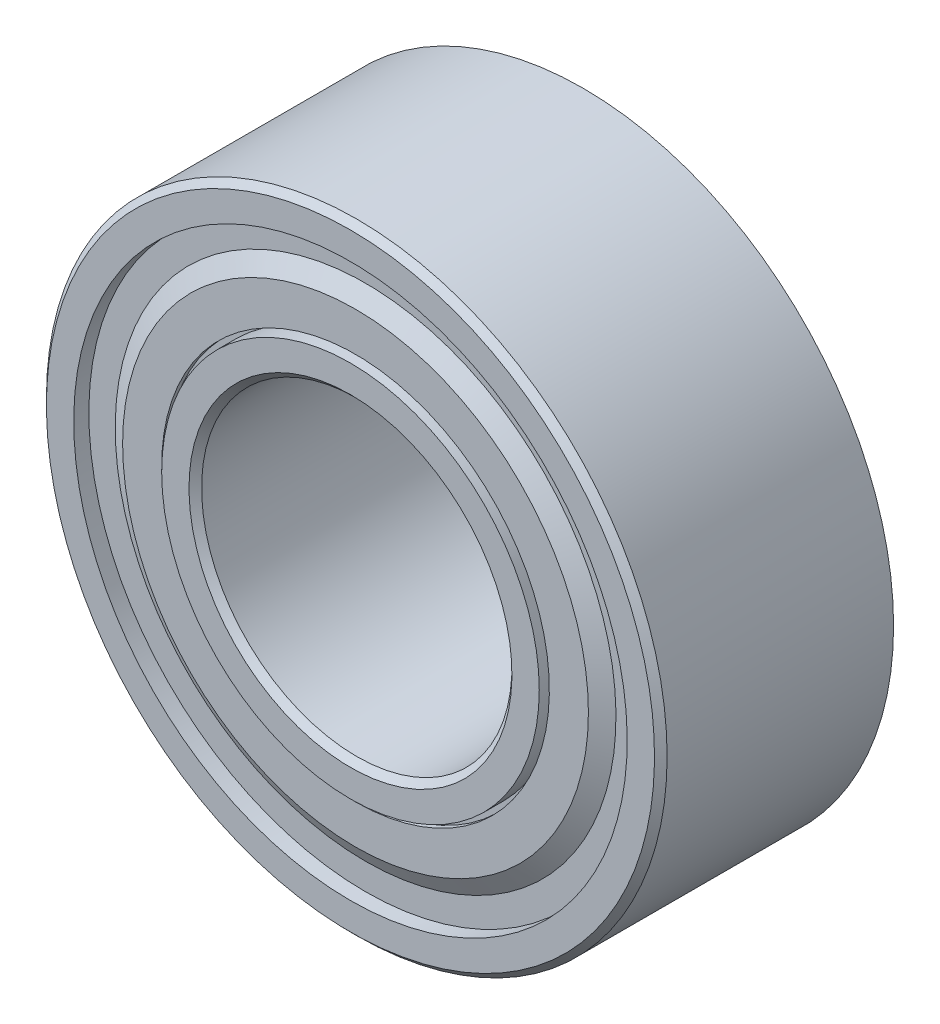
from build123d import *

# Parameters (mm, degrees)
FILLET1_SIZE            = 0.08125
FILLET2_SIZE            = 0.08125
CIRPATTERN3_COUNT       = 12
SKETCH8_W               = 0.26
SKETCH8_H               = 0.216666667
CUT_EXTRUDE1_DEPTH      = 8.163797875
CUT_EXTRUDE1_DEPTH_BACK = 8.163797875
SKETCH10_R              = 4.6
SKETCH10_R_2            = 4
BOSS_EXTRUDE1_START     = 0.397747564
SKETCH11_R              = 4
BOSS_EXTRUDE1_DEPTH     = 0.397747564
CUT_EXTRUDE2_DEPTH      = 7.046281526
CUT_EXTRUDE2_DEPTH_BACK = 7.046281526
SKETCH12_R              = 2


with BuildPart() as part:
    # Sketch2 → Revolve1 (revolve)
    with BuildSketch(Plane(origin=(0, 0, 0), x_dir=(0, 0, -1), z_dir=(1, 0, 0)), mode=Mode.PRIVATE) as revolve1_sk:
        with BuildLine():
            Line((1.5, 4.6), (0.9, 4.6))
            Line((0.9, 4.6), (0.9, 4.265165043))
            Line((0.9, 4.265165043), (1.032582521, 4.132582521))
            Line((1.032582521, 4.132582521), (1.032582521, 3.867417479))
            Line((1.032582521, 3.867417479), (0.767417479, 3.867417479))
            Line((0.767417479, 3.867417479), (0.634834957, 4))
            Line((0.634834957, 4), (-1.5, 4))
            Line((-1.5, 4), (-1.5, 3.35))
            Line((-1.5, 3.35), (-0.487339717, 3.35))
            ThreePointArc((-0.487339717, 3.35), (0, 3.6), (0.487339717, 3.35))
            Line((0.487339717, 3.35), (1.5, 3.35))
            Line((1.5, 3.35), (1.5, 4.6))
        make_face()
        with BuildLine():
            Line((1.5, 2), (-1.5, 2))
            Line((-1.5, 2), (-1.5, 2.65))
            Line((-1.5, 2.65), (-0.487339717, 2.65))
            ThreePointArc((-0.487339717, 2.65), (0, 2.4), (0.487339717, 2.65))
            Line((0.487339717, 2.65), (1.5, 2.65))
            Line((1.5, 2.65), (1.5, 2))
        make_face()
    revolve(revolve1_sk.sketch.rotate(Axis((0, 0, 0), (0, 0, -1)), 180), axis=Axis((0, 0, 0), (0, 0, -1)))

    # Fillet1
    fillet1_edges = [part.edges().sort_by_distance(p)[0] for p in [
        (0, 4, 1.5),
        (0, 4.6, -1.5),
        (0, 4.6, -0.9),
    ]]
    chamfer(fillet1_edges, length=FILLET1_SIZE)

    # Fillet2
    fillet2_edges = [part.edges().sort_by_distance(p)[0] for p in [
        (0, 2, -1.5),
        (0, 2, 1.5),
    ]]
    chamfer(fillet2_edges, length=FILLET2_SIZE)

    # Sketch8 → Cut-Revolve1 (revolve, cut)
    with BuildSketch(Plane(origin=(0, 0, 0), x_dir=(0, 0, -1), z_dir=(1, 0, 0)), mode=Mode.PRIVATE) as cut_revolve1_sk:
        with Locations((-1.37, 3.458333334)):
            Rectangle(SKETCH8_W, SKETCH8_H)
        with Locations((1.37, 3.458333334)):
            Rectangle(SKETCH8_W, SKETCH8_H)
        with Locations((1.37, 2.541666667)):
            Rectangle(SKETCH8_W, SKETCH8_H)
        with Locations((-1.37, 2.541666667)):
            Rectangle(SKETCH8_W, SKETCH8_H)
    revolve(cut_revolve1_sk.sketch.rotate(Axis((0, 0, 0), (0, 0, -1)), 180), axis=Axis((0, 0, 0), (0, 0, -1)), mode=Mode.SUBTRACT)

    # Sketch10 → Cut-Extrude1 (cut, two sides: drawn at the far end of the back side and taken through both)
    with BuildSketch(Plane.XY.offset(1.5).offset(-CUT_EXTRUDE1_DEPTH_BACK)):
        Circle(SKETCH10_R)
        with Locations(Location((0, 0, 0), (0, 0, 270))):
            Circle(SKETCH10_R_2, mode=Mode.SUBTRACT)
    extrude(amount=CUT_EXTRUDE1_DEPTH + CUT_EXTRUDE1_DEPTH_BACK, mode=Mode.SUBTRACT)

    # Sketch11 → Boss-Extrude1 (add)
    with BuildSketch(Plane.XY.offset(-1.032582521).offset(BOSS_EXTRUDE1_START)):
        Circle(SKETCH11_R)
    extrude(amount=-BOSS_EXTRUDE1_DEPTH)

    # Sketch12 → Cut-Extrude2 (cut, two sides: drawn at the far end of the back side and taken through both)
    with BuildSketch(Plane.XY.offset(-0.634834957).offset(-CUT_EXTRUDE2_DEPTH_BACK)):
        with Locations(Location((0, 0, 0), (0, 0, 270))):
            Circle(SKETCH12_R)
    extrude(amount=CUT_EXTRUDE2_DEPTH + CUT_EXTRUDE2_DEPTH_BACK, mode=Mode.SUBTRACT)


with BuildPart() as body_2:
    # Sketch7 → Revolve3 (revolve)
    with BuildSketch(Plane.XY):
        with BuildLine():
            Line((0, 3.6), (0, 2.4))
            ThreePointArc((0, 2.4), (-0.6, 3), (0, 3.6))
        make_face()
    revolve(axis=Axis((0, 3.6, 0), (0, -1, 0)))


with BuildPart() as cirpattern3_1:
    # CirPattern3: pattern copy
    add(body_2.part.rotate(Axis((0, 0, 0), (0, 0, 1)), 1 * 360 / CIRPATTERN3_COUNT))


with BuildPart() as cirpattern3_2:
    # CirPattern3: pattern copy
    add(body_2.part.rotate(Axis((0, 0, 0), (0, 0, 1)), 2 * 360 / CIRPATTERN3_COUNT))


with BuildPart() as cirpattern3_3:
    # CirPattern3: pattern copy
    add(body_2.part.rotate(Axis((0, 0, 0), (0, 0, 1)), 3 * 360 / CIRPATTERN3_COUNT))


with BuildPart() as cirpattern3_4:
    # CirPattern3: pattern copy
    add(body_2.part.rotate(Axis((0, 0, 0), (0, 0, 1)), 4 * 360 / CIRPATTERN3_COUNT))


with BuildPart() as cirpattern3_5:
    # CirPattern3: pattern copy
    add(body_2.part.rotate(Axis((0, 0, 0), (0, 0, 1)), 5 * 360 / CIRPATTERN3_COUNT))


with BuildPart() as cirpattern3_6:
    # CirPattern3: pattern copy
    add(body_2.part.rotate(Axis((0, 0, 0), (0, 0, 1)), 6 * 360 / CIRPATTERN3_COUNT))


with BuildPart() as cirpattern3_7:
    # CirPattern3: pattern copy
    add(body_2.part.rotate(Axis((0, 0, 0), (0, 0, 1)), 7 * 360 / CIRPATTERN3_COUNT))


with BuildPart() as cirpattern3_8:
    # CirPattern3: pattern copy
    add(body_2.part.rotate(Axis((0, 0, 0), (0, 0, 1)), 8 * 360 / CIRPATTERN3_COUNT))


with BuildPart() as cirpattern3_9:
    # CirPattern3: pattern copy
    add(body_2.part.rotate(Axis((0, 0, 0), (0, 0, 1)), 9 * 360 / CIRPATTERN3_COUNT))


with BuildPart() as cirpattern3_10:
    # CirPattern3: pattern copy
    add(body_2.part.rotate(Axis((0, 0, 0), (0, 0, 1)), 10 * 360 / CIRPATTERN3_COUNT))


with BuildPart() as cirpattern3_11:
    # CirPattern3: pattern copy
    add(body_2.part.rotate(Axis((0, 0, 0), (0, 0, 1)), 11 * 360 / CIRPATTERN3_COUNT))


with BuildPart() as body_14:
    # Sketch9 → Revolve4 (revolve)
    with BuildSketch(Plane(origin=(0, 0, 0), x_dir=(0, 0, -1), z_dir=(1, 0, 0)), mode=Mode.PRIVATE) as revolve4_sk:
        Polygon((-1.24, 3.566666667), (-1.24, 3.20952381), (-1.37, 2.984357205), (-1.37, 2.498333333), (-1.435, 2.498333333), (-1.435, 3.001773902), (-1.305, 3.226940507), (-1.305, 3.566666667), align=None)
        Polygon((1.24, 3.566666667), (1.24, 3.20952381), (1.37, 2.984357205), (1.37, 2.498333333), (1.435, 2.498333333), (1.435, 3.001773902), (1.305, 3.226940507), (1.305, 3.566666667), align=None)
    revolve(revolve4_sk.sketch.rotate(Axis((0, 0, 0), (0, 0, -1)), 180), axis=Axis((0, 0, 0), (0, 0, -1)))


solid = Compound([part.part, body_2.part, cirpattern3_1.part, cirpattern3_2.part, cirpattern3_3.part, cirpattern3_4.part, cirpattern3_5.part, cirpattern3_6.part, cirpattern3_7.part, cirpattern3_8.part, cirpattern3_9.part, cirpattern3_10.part, cirpattern3_11.part, body_14.part])
